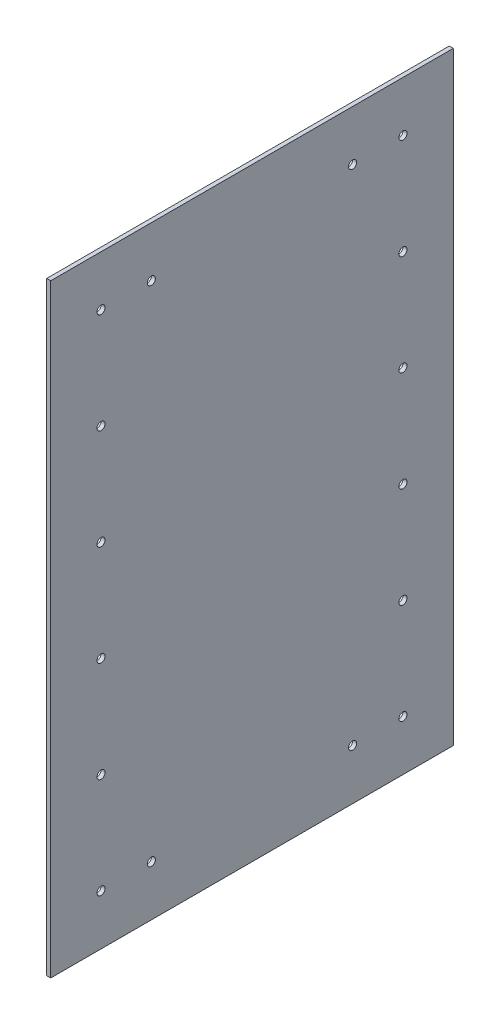
from build123d import *

# Parameters (mm, degrees)
SKETCH_1_W          = 200
SKETCH_1_H          = 300
EXTRUDE_1_DEPTH     = 2
SKETCH_2_R          = 2
CUT_EXTRUDE_1_DEPTH = 2


with BuildPart() as part:
    # Эскиз1 → Бобышка-Вытянуть1 (new body)
    with BuildSketch(Plane(origin=(0, 0, 0), x_dir=(0, 0, -1), z_dir=(1, 0, 0))):
        Rectangle(SKETCH_1_W, SKETCH_1_H)
    extrude(amount=EXTRUDE_1_DEPTH)

    # Эскиз2 → Вырез-Вытянуть1 (cut)
    with BuildSketch(Plane(origin=(2, 0, 0), x_dir=(0, 0, -1), z_dir=(1, 0, 0))):
        with Locations((-75, 125)):
            Circle(SKETCH_2_R)
        with Locations((75, 125)):
            Circle(SKETCH_2_R)
        with Locations((75, -125)):
            Circle(SKETCH_2_R)
        with Locations((-75, -125)):
            Circle(SKETCH_2_R)
        with Locations((-75, 75)):
            Circle(SKETCH_2_R)
        with Locations((-75, 25)):
            Circle(SKETCH_2_R)
        with Locations((75, 25)):
            Circle(SKETCH_2_R)
        with Locations((75, 75)):
            Circle(SKETCH_2_R)
        with Locations((-75, -25)):
            Circle(SKETCH_2_R)
        with Locations((75, -25)):
            Circle(SKETCH_2_R)
        with Locations((75, -75)):
            Circle(SKETCH_2_R)
        with Locations((-75, -75)):
            Circle(SKETCH_2_R)
        with Locations((-50, 125)):
            Circle(SKETCH_2_R)
        with Locations((50, 125)):
            Circle(SKETCH_2_R)
        with Locations((50, -125)):
            Circle(SKETCH_2_R)
        with Locations((-50, -125)):
            Circle(SKETCH_2_R)
    extrude(amount=-CUT_EXTRUDE_1_DEPTH, mode=Mode.SUBTRACT)


solid = part.part
